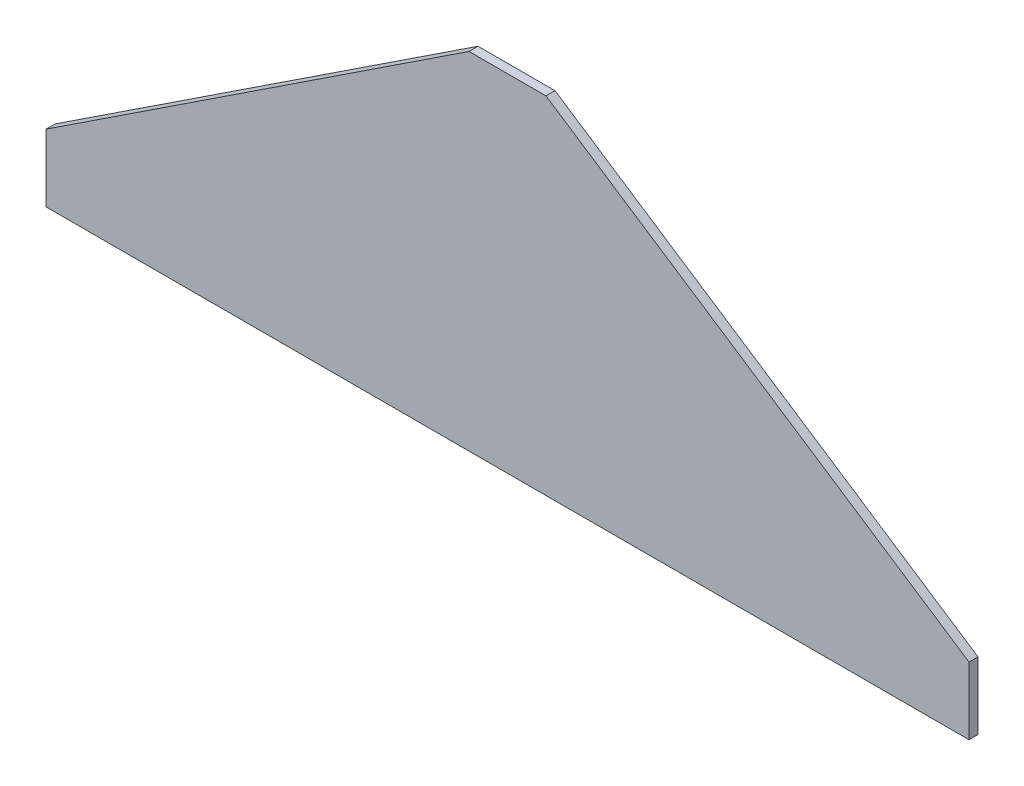
from build123d import *
from OCP.BRepFilletAPI import BRepFilletAPI_MakeChamfer

# Parameters (mm, degrees)
SKETCH1_W           = 1219.2
SKETCH1_H           = 457.2
BOSS_EXTRUDE1_DEPTH = 11.90625
CHAMFER1_SIZE       = 368.3
CHAMFER1_SIZE2      = 558.8


with BuildPart() as part:
    # Sketch1 → Boss-Extrude1 (new body)
    with BuildSketch(Plane.XY):
        Rectangle(SKETCH1_W, SKETCH1_H)
    extrude(amount=BOSS_EXTRUDE1_DEPTH)

    # Chamfer1: one chamfer whose edges measure the first distance from different faces: ONE call of the kernel's chamfer builder (chamfer() names one face for all edges)
    chamfer1_edges_1 = [part.edges().sort_by_distance(p)[0] for p in [
        (-609.6, 228.6, 5.953125),
    ]]
    chamfer1_side_1 = [part.faces().sort_by_distance(p)[0] for p in [
        (-609.6, 0, 5.953125),
    ]]
    chamfer1_edges_2 = [part.edges().sort_by_distance(p)[0] for p in [
        (609.6, 228.6, 5.953125),
    ]]
    chamfer1_side_2 = [part.faces().sort_by_distance(p)[0] for p in [
        (609.6, 0, 5.953125),
    ]]
    chamfer1 = BRepFilletAPI_MakeChamfer(part.part.solid().wrapped)
    for e in chamfer1_edges_1:
        chamfer1.Add(CHAMFER1_SIZE, CHAMFER1_SIZE2, e.wrapped, chamfer1_side_1[0].wrapped)  # the first distance lies on this face
    for e in chamfer1_edges_2:
        chamfer1.Add(CHAMFER1_SIZE, CHAMFER1_SIZE2, e.wrapped, chamfer1_side_2[0].wrapped)  # the first distance lies on this face
    add(Compound.cast(chamfer1.Shape()), mode=Mode.REPLACE)


solid = part.part
